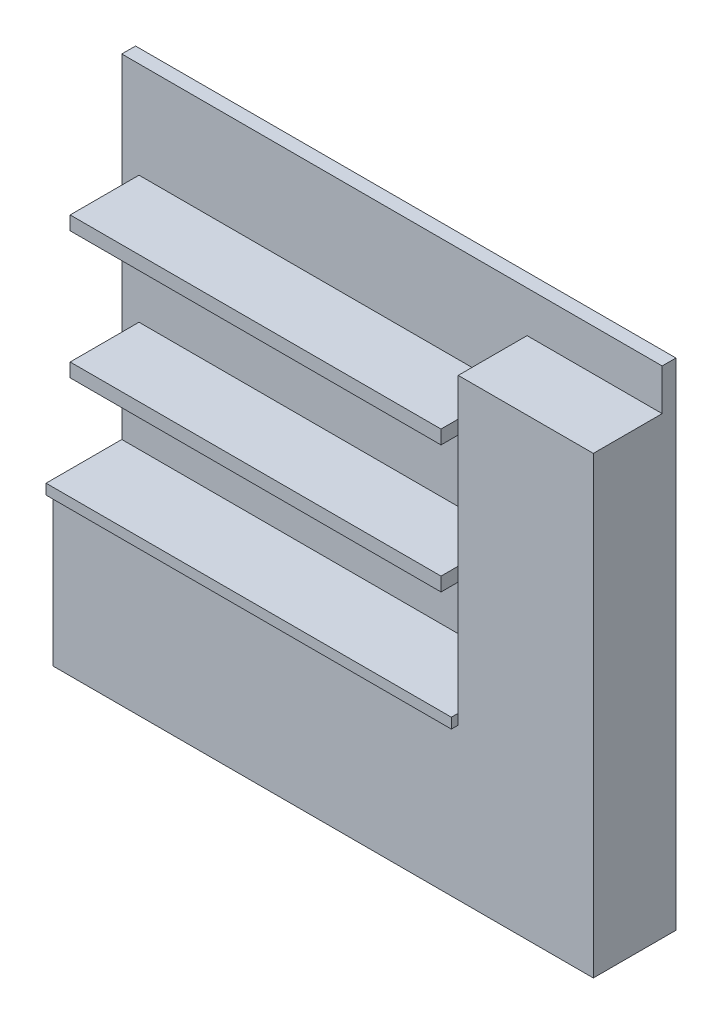
from build123d import *

# Parameters (mm, degrees)
SKETCH1_W           = 3987.8
SKETCH1_H           = 3657.6
BOSS_EXTRUDE1_DEPTH = 101.6
BOSS_EXTRUDE2_DEPTH = 508
SKETCH4_W           = 2990.85
SKETCH4_H           = 76.2
BOSS_EXTRUDE3_DEPTH = 558.8
SKETCH5_W           = 2736.85
SKETCH5_H           = 101.6
BOSS_EXTRUDE4_DEPTH = 508


with BuildPart() as part:
    # Sketch1 → Boss-Extrude1 (new body)
    with BuildSketch(Plane.XY):
        Rectangle(SKETCH1_W, SKETCH1_H)
    extrude(amount=BOSS_EXTRUDE1_DEPTH)

    # Sketch2 → Boss-Extrude2 (add)
    with BuildSketch(Plane.XY.offset(101.6)):
        Polygon((-1993.9, -1828.8), (-1993.9, -711.2), (996.95, -711.2), (996.95, 1524), (1993.9, 1524), (1993.9, -1828.8), align=None)
    extrude(amount=BOSS_EXTRUDE2_DEPTH)

    # Sketch4 → Boss-Extrude3 (add)
    with BuildSketch(Plane.XY.offset(101.6)):
        with Locations((-498.475, -673.1)):
            Rectangle(SKETCH4_W, SKETCH4_H)
    extrude(amount=BOSS_EXTRUDE3_DEPTH)

    # Sketch5 → Boss-Extrude4 (add)
    with BuildSketch(Plane.XY.offset(101.6)):
        with Locations((-498.475, 127)):
            Rectangle(SKETCH5_W, SKETCH5_H)
        with Locations((-498.475, 1066.8)):
            Rectangle(SKETCH5_W, SKETCH5_H)
    extrude(amount=BOSS_EXTRUDE4_DEPTH)


solid = part.part
